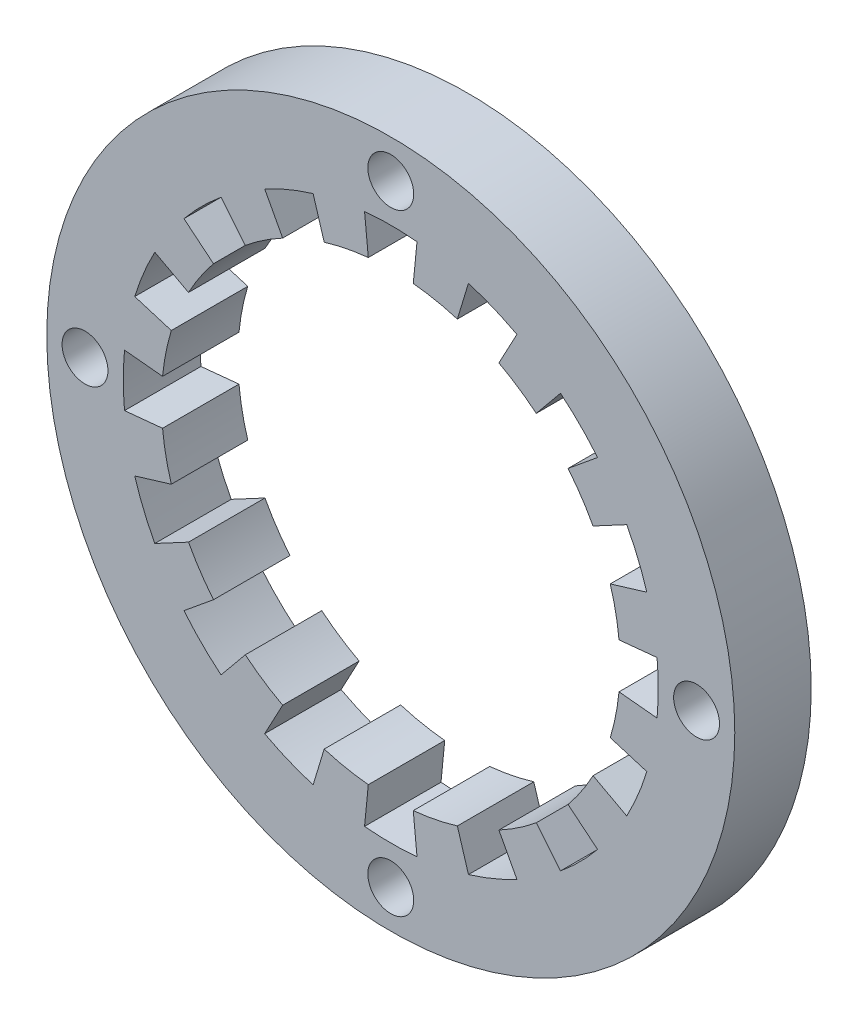
from build123d import *

# Parameters (mm, degrees)
EXTRUDE_1_DEPTH          = 5
EXTRUDE_1_DEPTH_BACK     = 5
SKETCH_1_R               = 45
CUT_EXTRUDE_1_DEPTH      = 64.835726674
CUT_EXTRUDE_1_DEPTH_BACK = 64.835726674
SKETCH_2_R               = 3


with BuildPart() as part:
    # 草图1 → 凸台-拉伸1 (new, two sides: drawn at the far end of the back side and taken through both)
    with BuildSketch(Plane.XY.offset(-EXTRUDE_1_DEPTH_BACK)):
        Circle(SKETCH_1_R)
        with BuildLine():
            Line((29.8555418, 2.94051421), (34.831465434, 3.430599912))
            ThreePointArc((34.831465434, 3.430599912), (35, 0), (34.831465434, -3.430599912))
            Line((34.831465434, -3.430599912), (29.8555418, -2.94051421))
            ThreePointArc((29.8555418, -2.94051421), (29.423558412, -5.85270966), (28.708210072, -8.708540318))
            Line((28.708210072, -8.708540318), (33.492911751, -10.159963704))
            ThreePointArc((33.492911751, -10.159963704), (32.335783638, -13.393920133), (30.867244252, -16.498885789))
            Line((30.867244252, -16.498885789), (26.45763793, -14.141902105))
            ThreePointArc((26.45763793, -14.141902105), (24.944088369, -16.667106991), (23.190313601, -19.031798525))
            Line((23.190313601, -19.031798525), (27.055365868, -22.203764946))
            ThreePointArc((27.055365868, -22.203764946), (24.748737342, -24.748737342), (22.203764946, -27.055365868))
            Line((22.203764946, -27.055365868), (19.031798525, -23.190313601))
            ThreePointArc((19.031798525, -23.190313601), (16.667106991, -24.944088369), (14.141902105, -26.45763793))
            Line((14.141902105, -26.45763793), (16.498885789, -30.867244252))
            ThreePointArc((16.498885789, -30.867244252), (13.393920133, -32.335783638), (10.159963704, -33.492911751))
            Line((10.159963704, -33.492911751), (8.708540318, -28.708210072))
            ThreePointArc((8.708540318, -28.708210072), (5.85270966, -29.423558412), (2.94051421, -29.8555418))
            Line((2.94051421, -29.8555418), (3.430599912, -34.831465434))
            ThreePointArc((3.430599912, -34.831465434), (0, -35), (-3.430599912, -34.831465434))
            Line((-3.430599912, -34.831465434), (-2.94051421, -29.8555418))
            ThreePointArc((-2.94051421, -29.8555418), (-5.85270966, -29.423558412), (-8.708540318, -28.708210072))
            Line((-8.708540318, -28.708210072), (-10.159963704, -33.492911751))
            ThreePointArc((-10.159963704, -33.492911751), (-13.393920133, -32.335783638), (-16.498885789, -30.867244252))
            Line((-16.498885789, -30.867244252), (-14.141902105, -26.45763793))
            ThreePointArc((-14.141902105, -26.45763793), (-16.667106991, -24.944088369), (-19.031798525, -23.190313601))
            Line((-19.031798525, -23.190313601), (-22.203764946, -27.055365868))
            ThreePointArc((-22.203764946, -27.055365868), (-24.748737342, -24.748737342), (-27.055365868, -22.203764946))
            Line((-27.055365868, -22.203764946), (-23.190313601, -19.031798525))
            ThreePointArc((-23.190313601, -19.031798525), (-24.944088369, -16.667106991), (-26.45763793, -14.141902105))
            Line((-26.45763793, -14.141902105), (-30.867244252, -16.498885789))
            ThreePointArc((-30.867244252, -16.498885789), (-32.335783638, -13.393920133), (-33.492911751, -10.159963704))
            Line((-33.492911751, -10.159963704), (-28.708210072, -8.708540318))
            ThreePointArc((-28.708210072, -8.708540318), (-29.423558412, -5.85270966), (-29.8555418, -2.94051421))
            Line((-29.8555418, -2.94051421), (-34.831465434, -3.430599912))
            ThreePointArc((-34.831465434, -3.430599912), (-35, 0), (-34.831465434, 3.430599912))
            Line((-34.831465434, 3.430599912), (-29.8555418, 2.94051421))
            ThreePointArc((-29.8555418, 2.94051421), (-29.423558412, 5.85270966), (-28.708210072, 8.708540318))
            Line((-28.708210072, 8.708540318), (-33.492911751, 10.159963704))
            ThreePointArc((-33.492911751, 10.159963704), (-32.335783638, 13.393920133), (-30.867244252, 16.498885789))
            Line((-30.867244252, 16.498885789), (-26.45763793, 14.141902105))
            ThreePointArc((-26.45763793, 14.141902105), (-24.944088369, 16.667106991), (-23.190313601, 19.031798525))
            Line((-23.190313601, 19.031798525), (-27.055365868, 22.203764946))
            ThreePointArc((-27.055365868, 22.203764946), (-24.748737342, 24.748737342), (-22.203764946, 27.055365868))
            Line((-22.203764946, 27.055365868), (-19.031798525, 23.190313601))
            ThreePointArc((-19.031798525, 23.190313601), (-16.667106991, 24.944088369), (-14.141902105, 26.45763793))
            Line((-14.141902105, 26.45763793), (-16.498885789, 30.867244252))
            ThreePointArc((-16.498885789, 30.867244252), (-13.393920133, 32.335783638), (-10.159963704, 33.492911751))
            Line((-10.159963704, 33.492911751), (-8.708540318, 28.708210072))
            ThreePointArc((-8.708540318, 28.708210072), (-5.85270966, 29.423558412), (-2.94051421, 29.8555418))
            Line((-2.94051421, 29.8555418), (-3.430599912, 34.831465434))
            ThreePointArc((-3.430599912, 34.831465434), (0, 35), (3.430599912, 34.831465434))
            Line((3.430599912, 34.831465434), (2.94051421, 29.8555418))
            ThreePointArc((2.94051421, 29.8555418), (5.85270966, 29.423558412), (8.708540318, 28.708210072))
            Line((8.708540318, 28.708210072), (10.159963704, 33.492911751))
            ThreePointArc((10.159963704, 33.492911751), (13.393920133, 32.335783638), (16.498885789, 30.867244252))
            Line((16.498885789, 30.867244252), (14.141902105, 26.45763793))
            ThreePointArc((14.141902105, 26.45763793), (16.667106991, 24.944088369), (19.031798525, 23.190313601))
            Line((19.031798525, 23.190313601), (22.203764946, 27.055365868))
            ThreePointArc((22.203764946, 27.055365868), (24.748737342, 24.748737342), (27.055365868, 22.203764946))
            Line((27.055365868, 22.203764946), (23.190313601, 19.031798525))
            ThreePointArc((23.190313601, 19.031798525), (24.944088369, 16.667106991), (26.45763793, 14.141902105))
            Line((26.45763793, 14.141902105), (30.867244252, 16.498885789))
            ThreePointArc((30.867244252, 16.498885789), (32.335783638, 13.393920133), (33.492911751, 10.159963704))
            Line((33.492911751, 10.159963704), (28.708210072, 8.708540318))
            ThreePointArc((28.708210072, 8.708540318), (29.423558412, 5.85270966), (29.8555418, 2.94051421))
        make_face(mode=Mode.SUBTRACT)
    extrude(amount=EXTRUDE_1_DEPTH + EXTRUDE_1_DEPTH_BACK)

    # 草图2 → 切除-拉伸1 (cut, two sides: drawn at the far end of the back side and taken through both)
    with BuildSketch(Plane.XY.offset(-CUT_EXTRUDE_1_DEPTH_BACK)):
        with Locations((40, 0)):
            Circle(SKETCH_2_R)
        with Locations((0, -40)):
            Circle(SKETCH_2_R)
        with Locations((-40, 0)):
            Circle(SKETCH_2_R)
        with Locations((0, 40)):
            Circle(SKETCH_2_R)
    extrude(amount=CUT_EXTRUDE_1_DEPTH + CUT_EXTRUDE_1_DEPTH_BACK, mode=Mode.SUBTRACT)


solid = part.part
